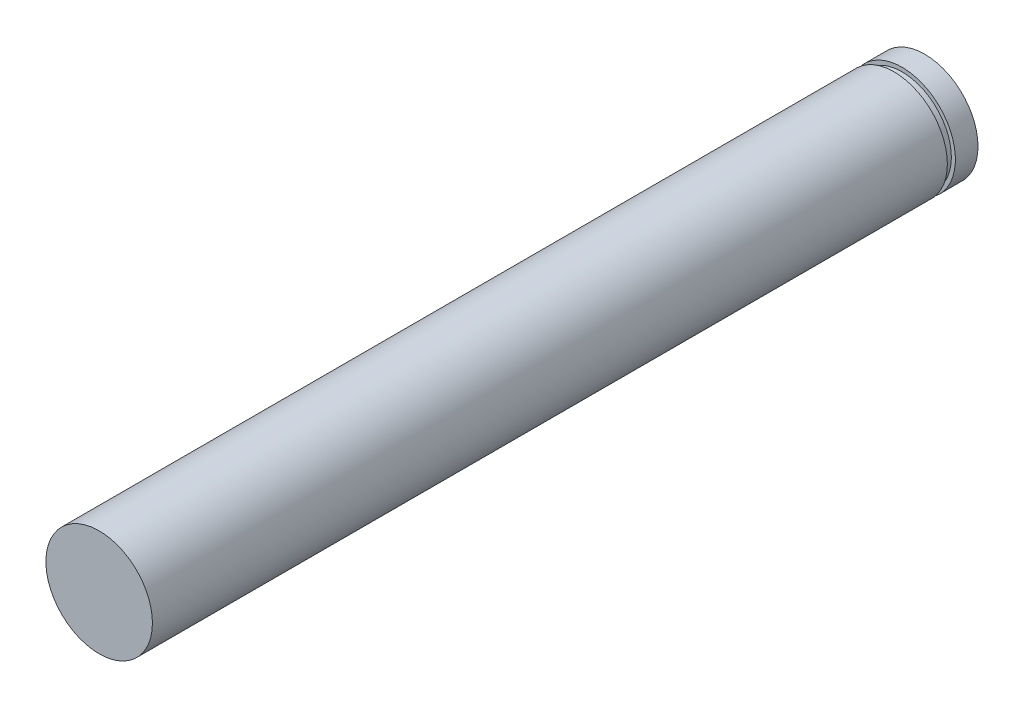
from build123d import *

# Parameters (mm, degrees)
SKETCH1_R           = 4
BOSS_EXTRUDE1_DEPTH = 62
SKETCH2_W           = 0.6
SKETCH2_H           = 0.6


with BuildPart() as part:
    # Sketch1 → Boss-Extrude1 (new body)
    with BuildSketch(Plane.XY):
        Circle(SKETCH1_R)
    extrude(amount=BOSS_EXTRUDE1_DEPTH)

    # Sketch2 → Cut-Revolve1 (revolve, cut)
    with BuildSketch(Plane(origin=(0, 0, 0), x_dir=(1, 0, 0), z_dir=(0, 1, 0))):
        with Locations((4, -2)):
            Rectangle(SKETCH2_W, SKETCH2_H)
    revolve(axis=Axis((0, 0, 62), (0, 0, -1)), mode=Mode.SUBTRACT)


solid = part.part
